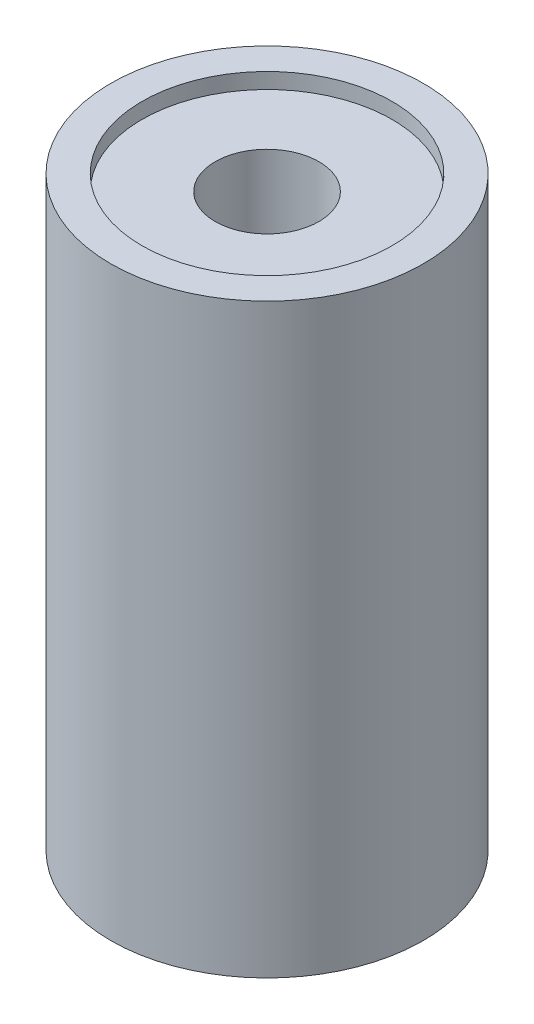
from build123d import *

# Parameters (mm, degrees)
BOSS_EXTRUDE1_DEPTH      = 23.8125
BOSS_EXTRUDE1_DEPTH_BACK = 23.8125
SKETCH1_R                = 12.7
SKETCH2_R                = 10.16
CUT_EXTRUDE1_DEPTH       = 1.27


with BuildPart() as part:
    # Sketch1 → Boss-Extrude1 (new, two sides: drawn at the far end of the back side and taken through both)
    with BuildSketch(Plane(origin=(0, 0, 0), x_dir=(1, 0, 0), z_dir=(0, 1, 0)).offset(-BOSS_EXTRUDE1_DEPTH_BACK)):
        Circle(SKETCH1_R)
    extrude(amount=BOSS_EXTRUDE1_DEPTH + BOSS_EXTRUDE1_DEPTH_BACK)

    # Sketch2 → Cut-Extrude1 (cut)
    with BuildSketch(Plane(origin=(0, 23.8125, 0), x_dir=(1, 0, 0), z_dir=(0, 1, 0))):
        Circle(SKETCH2_R)
    cut_extrude1 = extrude(amount=-CUT_EXTRUDE1_DEPTH, mode=Mode.SUBTRACT)

    # Sketch5 → 3/8-24 Tapped Hole1 (revolve, cut)
    with BuildSketch(Plane(origin=(0, 22.5425, 0), x_dir=(0, 0, 1), z_dir=(1, 0, 0))):
        Polygon((0, 0), (0, 18.535468714), (4.2164, 16.002), (4.2164, 0), align=None)
    f_3_8_24_tapped_hole1 = revolve(axis=Axis((0, 28.8925, 0), (0, -1, 0)), mode=Mode.SUBTRACT)

    # Mirror1: Cut-Extrude1, 3/8-24 Tapped Hole1 across plane
    add(cut_extrude1.mirror(Plane.ZX), mode=Mode.SUBTRACT)
    add(f_3_8_24_tapped_hole1.mirror(Plane.ZX), mode=Mode.SUBTRACT)


solid = part.part
